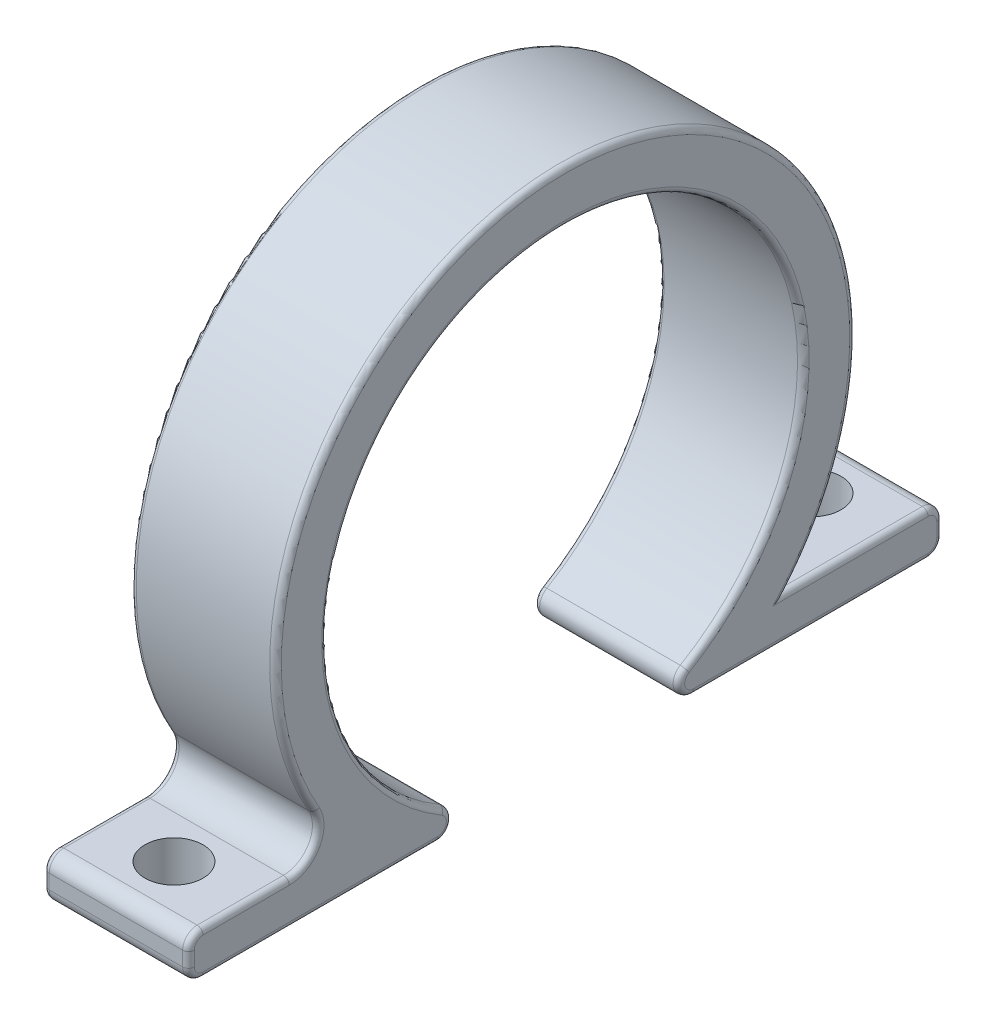
from build123d import *

# Parameters (mm, degrees)
EXTRUDE_1_DEPTH     = 5
CUT_EXTRUDE_1_REACH = 23.593
SKETCH_2_R          = 1
FILLET_1_R          = 0.2


with BuildPart() as part:
    # 草图1 → 凸台-拉伸1 (new body)
    with BuildSketch(Plane(origin=(0, 0, 0), x_dir=(0, 0, -1), z_dir=(1, 0, 0))):
        with BuildLine():
            Line((-12.5, -8), (-4.409081537, -8))
            ThreePointArc((-4.409081537, -8), (-3.926630896, -7.631306433), (-4.155686046, -7.068965517))
            ThreePointArc((-4.155686046, -7.068965517), (0, 8.2), (4.155686046, -7.068965517))
            ThreePointArc((4.155686046, -7.068965517), (3.926630896, -7.631306433), (4.409081537, -8))
            Line((4.409081537, -8), (12.5, -8))
            ThreePointArc((12.5, -8), (12.853553391, -7.853553391), (13, -7.5))
            Line((13, -7.5), (13, -7))
            ThreePointArc((13, -7), (12.853553391, -6.646446609), (12.5, -6.5))
            Line((12.5, -6.5), (7.599342077, -6.5))
            ThreePointArc((7.599342077, -6.5), (0.918631345, 9.957716428), (-8.660254038, -5))
            ThreePointArc((-8.660254038, -5), (-8.660254038, -6), (-9.526279442, -6.5))
            Line((-9.526279442, -6.5), (-12.5, -6.5))
            ThreePointArc((-12.5, -6.5), (-12.853553391, -6.646446609), (-13, -7))
            Line((-13, -7), (-13, -7.5))
            ThreePointArc((-13, -7.5), (-12.853553391, -7.853553391), (-12.5, -8))
        make_face()
    extrude(amount=EXTRUDE_1_DEPTH)

    # 草图2 → 切除-拉伸1 (cut, up to next)
    with BuildSketch(Plane(origin=(0, -6.5, 0), x_dir=(1, 0, 0), z_dir=(0, 1, 0)), mode=Mode.PRIVATE) as cut_extrude_1_sk1:
        with Locations(Location((2.5, -11, 0), (0, 0, 270))):
            Circle(SKETCH_2_R)
    cut_extrude_1_tool1 = extrude(cut_extrude_1_sk1.sketch, amount=-CUT_EXTRUDE_1_REACH, mode=Mode.PRIVATE) & part.part
    # 草图2 → 切除-拉伸1 (cut, up to next)
    with BuildSketch(Plane(origin=(0, -6.5, 0), x_dir=(1, 0, 0), z_dir=(0, 1, 0)), mode=Mode.PRIVATE) as cut_extrude_1_sk2:
        with Locations(Location((2.5, 11, 0), (0, 0, 270))):
            Circle(SKETCH_2_R)
    cut_extrude_1_tool2 = extrude(cut_extrude_1_sk2.sketch, amount=-CUT_EXTRUDE_1_REACH, mode=Mode.PRIVATE) & part.part
    add(cut_extrude_1_tool1.solids().sort_by_distance((2.5, -6.5, 11))[0], mode=Mode.SUBTRACT)
    add(cut_extrude_1_tool2.solids().sort_by_distance((2.5, -6.5, -11))[0], mode=Mode.SUBTRACT)

    # 圆角1
    fillet_1_edges = [part.edges().sort_by_distance(p)[0] for p in [
        (5, -6.646446609, -12.853553391),
        (5, -6.5, -10.049671038),
        (0, -8, -8.454540769),
        (0, -7.631306433, -3.926630896),
        (0, 8.2, 0),
        (0, -7.631306433, 3.926630896),
        (0, -8, 8.454540769),
        (0, -7.853553391, 12.853553391),
        (0, -7.25, 13),
        (5, 9.957716428, -0.918631345),
        (0, -6.646446609, 12.853553391),
        (0, -6.5, 11.013139721),
        (0, -6, 8.660254038),
        (0, 9.957716428, -0.918631345),
        (0, -6.5, -10.049671038),
        (0, -6.646446609, -12.853553391),
        (0, -7.25, -13),
        (0, -7.853553391, -12.853553391),
        (5, -6, 8.660254038),
        (5, -6.5, 11.013139721),
        (5, -6.646446609, 12.853553391),
        (5, -7.25, 13),
        (5, -7.853553391, 12.853553391),
        (5, -8, 8.454540769),
        (5, -7.631306433, 3.926630896),
        (5, -7.853553391, -12.853553391),
        (5, 8.2, 0),
        (5, -7.631306433, -3.926630896),
        (5, -8, -8.454540769),
        (5, -7.25, -13),
    ]]
    fillet(fillet_1_edges, radius=FILLET_1_R)


solid = part.part
